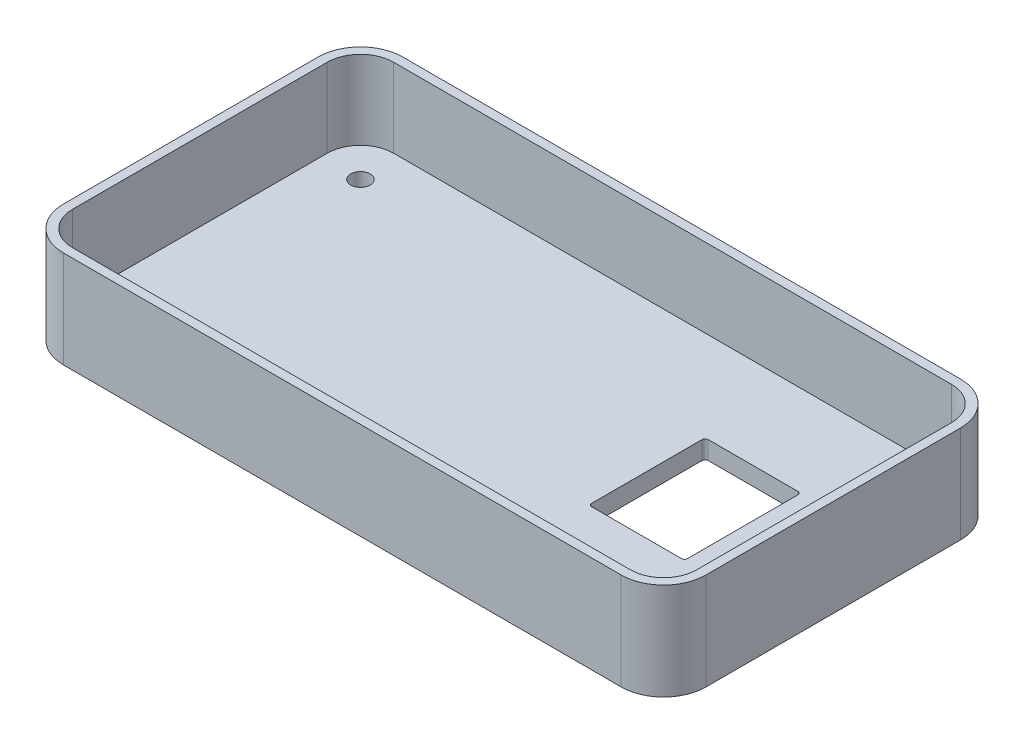
from build123d import *

# Parameters (mm, degrees)
SKETCH1_R           = 1.600003175
BOSS_EXTRUDE1_DEPTH = 3
BOSS_EXTRUDE2_DEPTH = 16


with BuildPart() as part:
    # Sketch1 → Boss-Extrude1 (new body)
    with BuildSketch(Plane(origin=(0, 0, 0), x_dir=(1, 0, 0), z_dir=(0, 1, 0))):
        with BuildLine():
            ThreePointArc((102.987500635, 46.00009144), (100.940965623, 50.940864023), (96.00019304, 52.987399035))
            Line((96.00019304, 52.987399035), (4.00000762, 52.987399035))
            ThreePointArc((4.00000762, 52.987399035), (-0.940764962, 50.940864023), (-2.987299975, 46.00009144))
            Line((-2.987299975, 46.00009144), (-2.987299975, 4.00000762))
            ThreePointArc((-2.987299975, 4.00000762), (-0.940764962, -0.940764962), (4.00000762, -2.987299975))
            Line((4.00000762, -2.987299975), (96.00019304, -2.987299975))
            ThreePointArc((96.00019304, -2.987299975), (100.940965623, -0.940764962), (102.987500635, 4.00000762))
            Line((102.987500635, 4.00000762), (102.987500635, 46.00009144))
        make_face()
        with Locations((5.00001016, 5.00001016)):
            Circle(SKETCH1_R, mode=Mode.SUBTRACT)
        with Locations((95.0001905, 5.00001016)):
            Circle(SKETCH1_R, mode=Mode.SUBTRACT)
        with Locations((5.00001016, 45.0000889)):
            Circle(SKETCH1_R, mode=Mode.SUBTRACT)
        with BuildLine():
            ThreePointArc((70.327156827, 36.027051041), (70.473603433, 36.380604424), (70.827156816, 36.52705103))
            Line((70.827156816, 36.52705103), (85.627156504, 36.52705103))
            ThreePointArc((85.627156504, 36.52705103), (85.980709887, 36.380604424), (86.127156493, 36.027051041))
            Line((86.127156493, 36.027051041), (86.127156493, 17.827051425))
            ThreePointArc((86.127156493, 17.827051425), (85.980709887, 17.473498042), (85.627156504, 17.327051436))
            Line((85.627156504, 17.327051436), (70.827156816, 17.327051436))
            ThreePointArc((70.827156816, 17.327051436), (70.473603433, 17.473498042), (70.327156827, 17.827051425))
            Line((70.327156827, 17.827051425), (70.327156827, 36.027051041))
        make_face(mode=Mode.SUBTRACT)
        with Locations((95.0001905, 45.0000889)):
            Circle(SKETCH1_R, mode=Mode.SUBTRACT)
    extrude(amount=BOSS_EXTRUDE1_DEPTH)

    # Sketch1<3> → Boss-Extrude2 (add)
    with BuildSketch(Plane(origin=(0, 0, 0), x_dir=(1, 0, 0), z_dir=(0, 1, 0))):
        with BuildLine():
            Line((96.00019304, 52.987399035), (4.00000762, 52.987399035))
            ThreePointArc((4.00000762, 52.987399035), (-0.940764962, 50.940864023), (-2.987299975, 46.00009144))
            Line((-2.987299975, 46.00009144), (-2.987299975, 4.00000762))
            ThreePointArc((-2.987299975, 4.00000762), (-0.940764962, -0.940764962), (4.00000762, -2.987299975))
            Line((4.00000762, -2.987299975), (96.00019304, -2.987299975))
            ThreePointArc((96.00019304, -2.987299975), (100.940965623, -0.940764962), (102.987500635, 4.00000762))
            Line((102.987500635, 4.00000762), (102.987500635, 46.00009144))
            ThreePointArc((102.987500635, 46.00009144), (100.940965623, 50.940864023), (96.00019304, 52.987399035))
        make_face()
        with BuildLine():
            Line((4.00000762, 51.487399035), (96.00019304, 51.487399035))
            ThreePointArc((96.00019304, 51.487399035), (99.880305451, 49.880203851), (101.487500635, 46.00009144))
            Line((101.487500635, 46.00009144), (101.487500635, 4.00000762))
            ThreePointArc((101.487500635, 4.00000762), (99.880305451, 0.119895209), (96.00019304, -1.487299975))
            Line((96.00019304, -1.487299975), (4.00000762, -1.487299975))
            ThreePointArc((4.00000762, -1.487299975), (0.119895209, 0.119895209), (-1.487299975, 4.00000762))
            Line((-1.487299975, 4.00000762), (-1.487299975, 46.00009144))
            ThreePointArc((-1.487299975, 46.00009144), (0.119895209, 49.880203851), (4.00000762, 51.487399035))
        make_face(mode=Mode.SUBTRACT)
    extrude(amount=BOSS_EXTRUDE2_DEPTH)


solid = part.part
